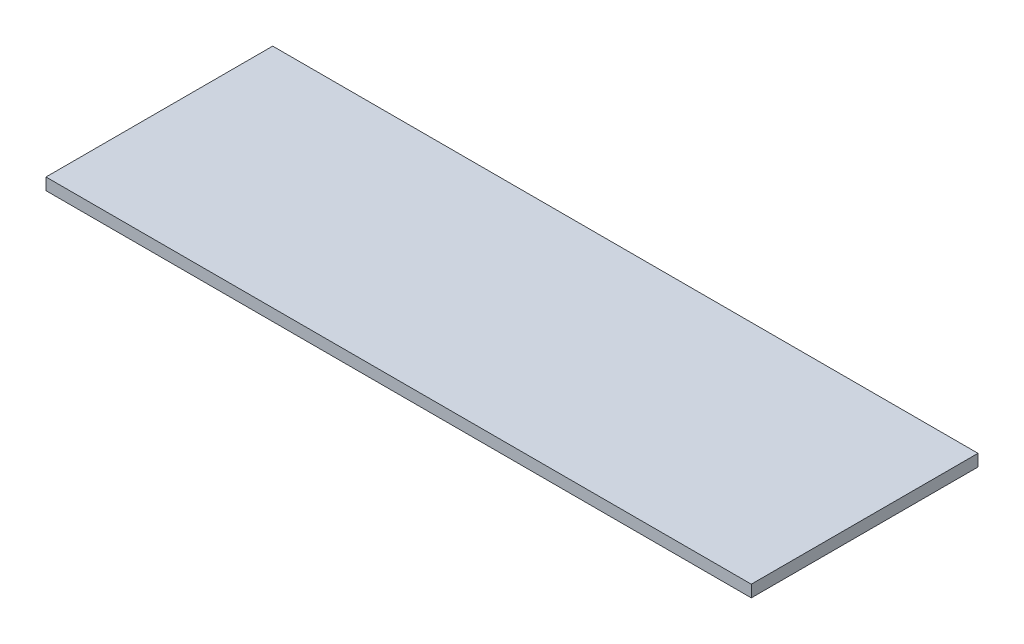
from build123d import *

# Parameters (mm, degrees)
SKETCH1_W           = 177.8
SKETCH1_H           = 57.15
BOSS_EXTRUDE1_DEPTH = 3


with BuildPart() as part:
    # Sketch1 → Boss-Extrude1 (new body)
    with BuildSketch(Plane(origin=(0, 0, 0), x_dir=(1, 0, 0), z_dir=(0, 1, 0))):
        with Locations((88.9, 28.575)):
            Rectangle(SKETCH1_W, SKETCH1_H)
    extrude(amount=BOSS_EXTRUDE1_DEPTH)


solid = part.part
